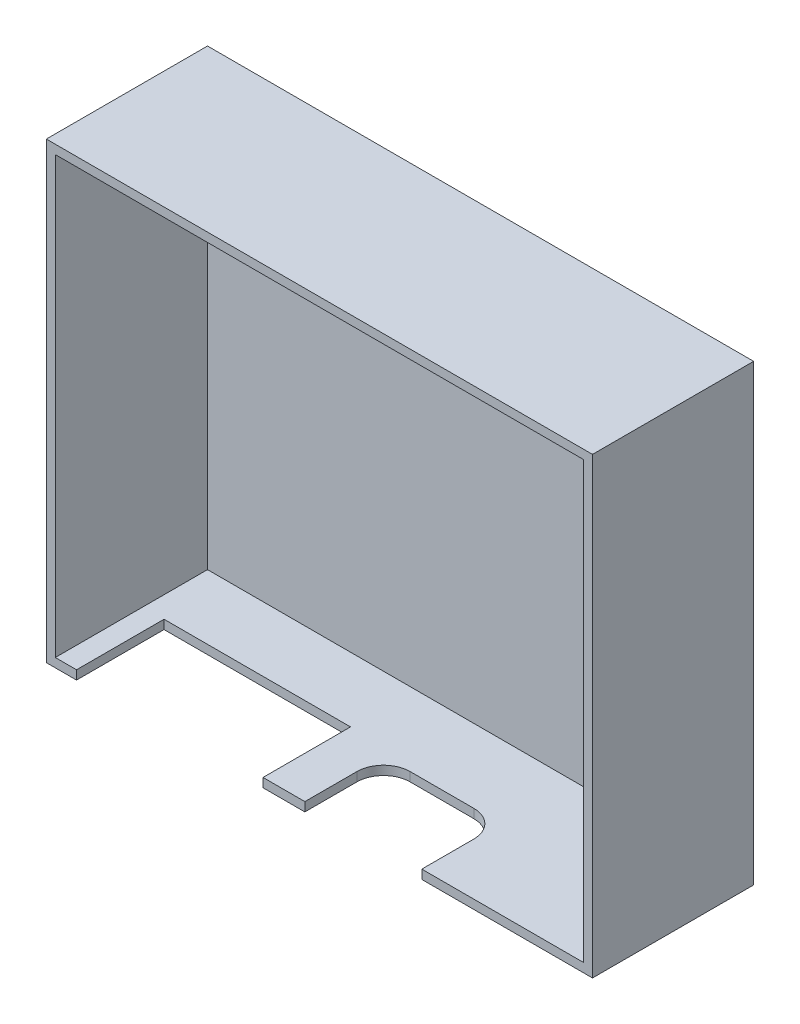
from build123d import *

# Parameters (mm, degrees)
SKETCH1_W            = 122
SKETCH1_H            = 101.3
BOSS_EXTRUDE1_DEPTH  = 18
SKETCH2_W            = 118
SKETCH2_H            = 97.3
CUT_EXTRUDE1_DEPTH   = 34
SKETCH4_R            = 5.953519792
CUT_EXTRUDE5_DEPTH   = 2
SKETCH5_W            = 41.658553798
SKETCH5_H            = 19.550778972
CUT_EXTRUDE10_DEPTH  = 2
SKETCH9_W            = 11.907039584
SKETCH9_H            = 11.615
CUT_EXTRUDE12_DEPTH  = 5
SKETCH10_W           = 11.907039584
SKETCH10_H           = 11.615
CUT_EXTRUDE13_DEPTH  = 5
SKETCH11_R           = 1.25
BOSS_EXTRUDE6_DEPTH  = 17
SKETCH14_R           = 1.25
BOSS_EXTRUDE8_DEPTH  = 17
SKETCH15_R           = 1.25
BOSS_EXTRUDE10_DEPTH = 17
SKETCH16_W           = 14.214546847
SKETCH16_H           = 17.568519792
CUT_EXTRUDE14_DEPTH  = 5
SKETCH17_R           = 1.6
BOSS_EXTRUDE11_DEPTH = 1
BOSS_EXTRUDE11_TAPER = 20
SKETCH18_R           = 1.6
BOSS_EXTRUDE13_DEPTH = 1
BOSS_EXTRUDE13_TAPER = 20
SKETCH19_R           = 1.513275
BOSS_EXTRUDE14_DEPTH = 1
BOSS_EXTRUDE14_TAPER = 20


with BuildPart() as part:
    # Sketch1 → Boss-Extrude1 (new, symmetric)
    with BuildSketch(Plane.XY):
        with Locations((129.5, -82.15)):
            Rectangle(SKETCH1_W, SKETCH1_H)
    extrude(amount=BOSS_EXTRUDE1_DEPTH, both=True)

    # Sketch2 → Cut-Extrude1 (cut)
    with BuildSketch(Plane.XY.offset(18)):
        with Locations((129.5, -82.15)):
            Rectangle(SKETCH2_W, SKETCH2_H)
    extrude(amount=-CUT_EXTRUDE1_DEPTH, mode=Mode.SUBTRACT)

    # Sketch4 → Cut-Extrude5 (cut)
    with BuildSketch(Plane(origin=(0, -132.8, 0), x_dir=(-1, 0, 0), z_dir=(0, -1, 0))):
        with Locations(Location((-132.2, -6.385, 0), (0, 0, 90))):
            Circle(SKETCH4_R)
        with Locations(Location((-146.414546847, -6.385, 0), (0, 0, 90))):
            Circle(SKETCH4_R)
    extrude(amount=-CUT_EXTRUDE5_DEPTH, mode=Mode.SUBTRACT)

    # Sketch5 → Cut-Extrude10 (cut)
    with BuildSketch(Plane(origin=(0, -132.8, 0), x_dir=(-1, 0, 0), z_dir=(0, -1, 0))):
        with Locations((-96.070620406, -8.224610514)):
            Rectangle(SKETCH5_W, SKETCH5_H)
    extrude(amount=-CUT_EXTRUDE10_DEPTH, mode=Mode.SUBTRACT)

    # Sketch9 → Cut-Extrude12 (cut)
    with BuildSketch(Plane(origin=(0, -132.8, 0), x_dir=(-1, 0, 0), z_dir=(0, -1, 0))):
        with Locations((-146.414546847, -12.1925)):
            Rectangle(SKETCH9_W, SKETCH9_H)
    extrude(amount=-CUT_EXTRUDE12_DEPTH, mode=Mode.SUBTRACT)

    # Sketch10 → Cut-Extrude13 (cut)
    with BuildSketch(Plane(origin=(0, -132.8, 0), x_dir=(-1, 0, 0), z_dir=(0, -1, 0))):
        with Locations((-132.2, -12.1925)):
            Rectangle(SKETCH10_W, SKETCH10_H)
    extrude(amount=-CUT_EXTRUDE13_DEPTH, mode=Mode.SUBTRACT)

    # Sketch11 → Boss-Extrude6 (add)
    with BuildSketch(Plane.XY.offset(-16)):
        with Locations((91.5, -40.5)):
            Circle(SKETCH11_R)
    extrude(amount=BOSS_EXTRUDE6_DEPTH)

    # Sketch14 → Boss-Extrude8 (add)
    with BuildSketch(Plane.XY.offset(-16)):
        with Locations((166.43, -40.5)):
            Circle(SKETCH14_R)
    extrude(amount=BOSS_EXTRUDE8_DEPTH)

    # Sketch15 → Boss-Extrude10 (add)
    with BuildSketch(Plane.XY.offset(-16)):
        with Locations((180.9, -126.3)):
            Circle(SKETCH15_R)
    extrude(amount=BOSS_EXTRUDE10_DEPTH)

    # Sketch16 → Cut-Extrude14 (cut)
    with BuildSketch(Plane(origin=(0, -132.8, 0), x_dir=(-1, 0, 0), z_dir=(0, -1, 0))):
        with Locations((-139.307273424, -9.215740104)):
            Rectangle(SKETCH16_W, SKETCH16_H)
    extrude(amount=-CUT_EXTRUDE14_DEPTH, mode=Mode.SUBTRACT)

    # Sketch17 → Boss-Extrude11 (add)
    with BuildSketch(Plane.XY.offset(-16)):
        with Locations((91.5, -40.5)):
            Circle(SKETCH17_R)
    extrude(amount=BOSS_EXTRUDE11_DEPTH, taper=BOSS_EXTRUDE11_TAPER)

    # Sketch18 → Boss-Extrude13 (add)
    with BuildSketch(Plane.XY.offset(-16)):
        with Locations((166.43, -40.5)):
            Circle(SKETCH18_R)
    extrude(amount=BOSS_EXTRUDE13_DEPTH, taper=BOSS_EXTRUDE13_TAPER)

    # Sketch19 → Boss-Extrude14 (add)
    with BuildSketch(Plane.XY.offset(-16)):
        with Locations((180.9, -126.3)):
            Circle(SKETCH19_R)
    extrude(amount=BOSS_EXTRUDE14_DEPTH, taper=BOSS_EXTRUDE14_TAPER)


solid = part.part
